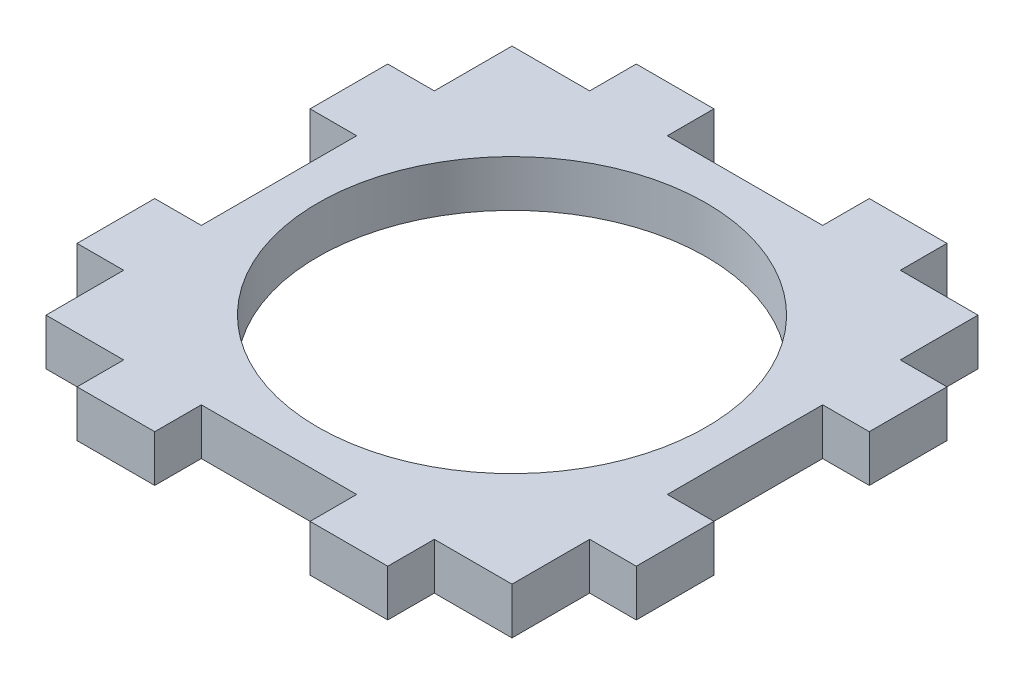
from build123d import *

# Parameters (mm, degrees)
SKETCH1_W           = 60
SKETCH1_H           = 60
SKETCH1_R           = 25
SKETCH1_W_2         = 10
SKETCH1_H_2         = 6
SKETCH1_W_3         = 6
SKETCH1_H_3         = 10
BOSS_EXTRUDE1_DEPTH = 6


with BuildPart() as part:
    # Sketch1 → Boss-Extrude1 (new body)
    # profile 1 of 9: a face of its own
    with BuildSketch(Plane(origin=(0, 0, 0), x_dir=(1, 0, 0), z_dir=(0, 1, 0))):
        Rectangle(SKETCH1_W, SKETCH1_H)
        with Locations(Location((0, 0, 0), (0, 0, 270))):
            Circle(SKETCH1_R, mode=Mode.SUBTRACT)
    # profile 2 of 9: a face of its own
    with BuildSketch(Plane(origin=(0, 0, 0), x_dir=(1, 0, 0), z_dir=(0, 1, 0))):
        with Locations((15, -33)):
            Rectangle(SKETCH1_W_2, SKETCH1_H_2)
    # profile 3 of 9: a face of its own
    with BuildSketch(Plane(origin=(0, 0, 0), x_dir=(1, 0, 0), z_dir=(0, 1, 0))):
        with Locations((-15, -33)):
            Rectangle(SKETCH1_W_2, SKETCH1_H_2)
    # profile 4 of 9: a face of its own
    with BuildSketch(Plane(origin=(0, 0, 0), x_dir=(1, 0, 0), z_dir=(0, 1, 0))):
        with Locations((-33, -15)):
            Rectangle(SKETCH1_W_3, SKETCH1_H_3)
    # profile 5 of 9: a face of its own
    with BuildSketch(Plane(origin=(0, 0, 0), x_dir=(1, 0, 0), z_dir=(0, 1, 0))):
        with Locations((-33, 15)):
            Rectangle(SKETCH1_W_3, SKETCH1_H_3)
    # profile 6 of 9: a face of its own
    with BuildSketch(Plane(origin=(0, 0, 0), x_dir=(1, 0, 0), z_dir=(0, 1, 0))):
        with Locations((-15, 33)):
            Rectangle(SKETCH1_W_2, SKETCH1_H_2)
    # profile 7 of 9: a face of its own
    with BuildSketch(Plane(origin=(0, 0, 0), x_dir=(1, 0, 0), z_dir=(0, 1, 0))):
        with Locations((15, 33)):
            Rectangle(SKETCH1_W_2, SKETCH1_H_2)
    # profile 8 of 9: a face of its own
    with BuildSketch(Plane(origin=(0, 0, 0), x_dir=(1, 0, 0), z_dir=(0, 1, 0))):
        with Locations((33, 15)):
            Rectangle(SKETCH1_W_3, SKETCH1_H_3)
    # profile 9 of 9: a face of its own
    with BuildSketch(Plane(origin=(0, 0, 0), x_dir=(1, 0, 0), z_dir=(0, 1, 0))):
        with Locations((33, -15)):
            Rectangle(SKETCH1_W_3, SKETCH1_H_3)
    extrude(amount=BOSS_EXTRUDE1_DEPTH)


solid = part.part
